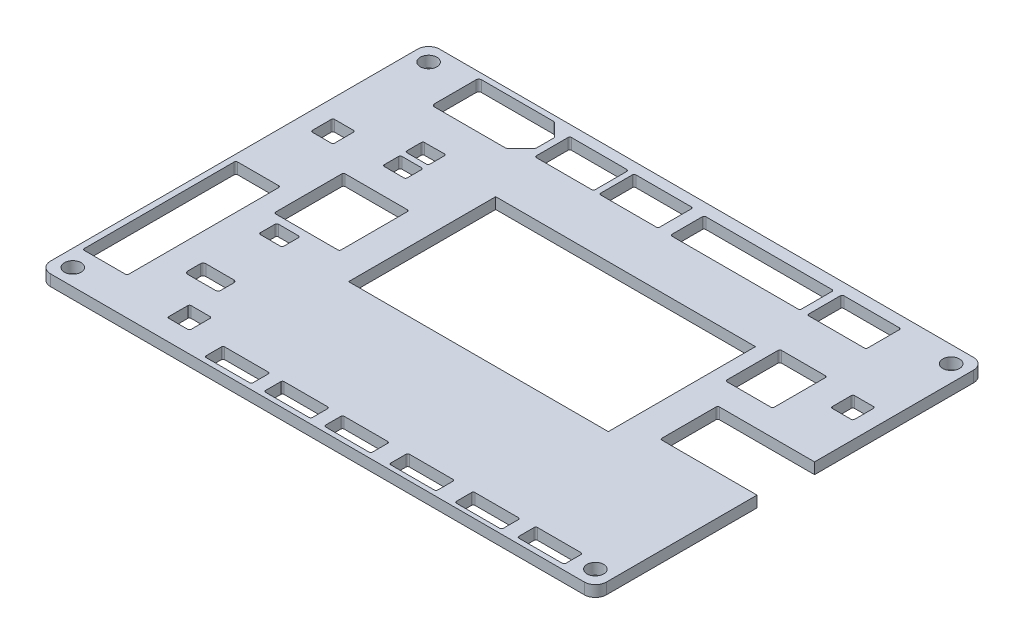
from build123d import *

# Parameters (mm, degrees)
SKETCH_1_R          = 1.5
EXTRUDE_1_DEPTH     = 2
SKETCH_2_W          = 46.726665624
SKETCH_2_H          = 26.469314584
CUT_EXTRUDE_1_DEPTH = 2


with BuildPart() as part:
    # 草图1 → 凸台-拉伸1 (new body)
    with BuildSketch(Plane(origin=(0, 0, 0), x_dir=(1, 0, 0), z_dir=(0, 1, 0))):
        with BuildLine():
            Line((-48, 35), (48, 35))
            ThreePointArc((48, 35), (49.414213562, 34.414213562), (50, 33))
            Line((50, 33), (50, -33))
            ThreePointArc((50, -33), (49.414213562, -34.414213562), (48, -35))
            Line((48, -35), (-48, -35))
            ThreePointArc((-48, -35), (-49.414213562, -34.414213562), (-50, -33))
            Line((-50, -33), (-50, 33))
            ThreePointArc((-50, 33), (-49.414213562, 34.414213562), (-48, 35))
        make_face()
        with Locations(Location((-47, 32, 0), (0, 0, 270))):
            Circle(SKETCH_1_R, mode=Mode.SUBTRACT)
        with Locations(Location((-47, -32, 0), (0, 0, 90))):
            Circle(SKETCH_1_R, mode=Mode.SUBTRACT)
        with Locations(Location((47, -32, 0), (0, 0, 270))):
            Circle(SKETCH_1_R, mode=Mode.SUBTRACT)
        with Locations(Location((47, 32, 0), (0, 0, 90))):
            Circle(SKETCH_1_R, mode=Mode.SUBTRACT)
    extrude(amount=EXTRUDE_1_DEPTH)

    # 草图2 → 切除-拉伸1 (cut)
    with BuildSketch(Plane(origin=(0, 2, 0), x_dir=(1, 0, 0), z_dir=(0, 1, 0))):
        with BuildLine():
            Line((-39.46866551, 34), (-26.523968408, 34))
            ThreePointArc((-26.523968408, 34), (-26.332626692, 33.961939766), (-26.170415017, 33.853553391))
            Line((-26.170415017, 33.853553391), (-24.054594438, 31.737732811))
            ThreePointArc((-24.054594438, 31.737732811), (-23.946208062, 31.575521137), (-23.908147829, 31.384179421))
            Line((-23.908147829, 31.384179421), (-23.908147829, 28.356333688))
            ThreePointArc((-23.908147829, 28.356333688), (-23.946208062, 28.164991972), (-24.054594438, 28.002780298))
            Line((-24.054594438, 28.002780298), (-26.385088906, 25.67228583))
            ThreePointArc((-26.385088906, 25.67228583), (-26.54730058, 25.563899454), (-26.738642296, 25.525839221))
            Line((-26.738642296, 25.525839221), (-39.46866551, 25.525839221))
            ThreePointArc((-39.46866551, 25.525839221), (-39.822218901, 25.67228583), (-39.96866551, 26.025839221))
            Line((-39.96866551, 26.025839221), (-39.96866551, 33.5))
            ThreePointArc((-39.96866551, 33.5), (-39.822218901, 33.853553391), (-39.46866551, 34))
        make_face()
        with BuildLine():
            Line((-46.520065793, 14.605798385), (-43.120065793, 14.605798385))
            ThreePointArc((-43.120065793, 14.605798385), (-42.907933759, 14.51793042), (-42.820065793, 14.305798385))
            Line((-42.820065793, 14.305798385), (-42.820065793, 10.905798385))
            ThreePointArc((-42.820065793, 10.905798385), (-42.907933759, 10.693666351), (-43.120065793, 10.605798385))
            Line((-43.120065793, 10.605798385), (-46.520065793, 10.605798385))
            ThreePointArc((-46.520065793, 10.605798385), (-46.732197828, 10.693666351), (-46.820065793, 10.905798385))
            Line((-46.820065793, 10.905798385), (-46.820065793, 14.305798385))
            ThreePointArc((-46.820065793, 14.305798385), (-46.732197828, 14.51793042), (-46.520065793, 14.605798385))
        make_face()
        with BuildLine():
            Line((-30.416933549, -27.303785472), (-27.016933549, -27.303785472))
            ThreePointArc((-27.016933549, -27.303785472), (-26.804801515, -27.391653437), (-26.716933549, -27.603785472))
            Line((-26.716933549, -27.603785472), (-26.716933549, -31.003785472))
            ThreePointArc((-26.716933549, -31.003785472), (-26.804801515, -31.215917506), (-27.016933549, -31.303785472))
            Line((-27.016933549, -31.303785472), (-30.416933549, -31.303785472))
            ThreePointArc((-30.416933549, -31.303785472), (-30.629065583, -31.215917506), (-30.716933549, -31.003785472))
            Line((-30.716933549, -31.003785472), (-30.716933549, -27.603785472))
            ThreePointArc((-30.716933549, -27.603785472), (-30.629065583, -27.391653437), (-30.416933549, -27.303785472))
        make_face()
        with BuildLine():
            Line((43.275791048, 18.342649885), (46.675791048, 18.342649885))
            ThreePointArc((46.675791048, 18.342649885), (46.887923083, 18.254781919), (46.975791048, 18.042649885))
            Line((46.975791048, 18.042649885), (46.975791048, 14.642649885))
            ThreePointArc((46.975791048, 14.642649885), (46.887923083, 14.430517851), (46.675791048, 14.342649885))
            Line((46.675791048, 14.342649885), (43.275791048, 14.342649885))
            ThreePointArc((43.275791048, 14.342649885), (43.063659014, 14.430517851), (42.975791048, 14.642649885))
            Line((42.975791048, 14.642649885), (42.975791048, 18.042649885))
            ThreePointArc((42.975791048, 18.042649885), (43.063659014, 18.254781919), (43.275791048, 18.342649885))
        make_face()
        with BuildLine():
            Line((-48.919287341, -14.819284761), (-48.919287341, -28.019284761))
            ThreePointArc((-48.919287341, -28.019284761), (-48.831419376, -28.231416796), (-48.619287341, -28.319284761))
            Line((-48.619287341, -28.319284761), (-41.219287341, -28.319284761))
            ThreePointArc((-41.219287341, -28.319284761), (-41.007155307, -28.231416796), (-40.919287341, -28.019284761))
            Line((-40.919287341, -28.019284761), (-40.919287341, -14.819284761))
            Line((-40.919287341, -14.819284761), (-40.919287341, -1.047678618))
            ThreePointArc((-40.919287341, -1.047678618), (-41.007155307, -0.835546583), (-41.219287341, -0.747678618))
            Line((-41.219287341, -0.747678618), (-48.619287341, -0.747678618))
            ThreePointArc((-48.619287341, -0.747678618), (-48.831419376, -0.835546583), (-48.919287341, -1.047678618))
            Line((-48.919287341, -1.047678618), (-48.919287341, -14.819284761))
        make_face()
        with BuildLine():
            Line((-22.406238703, 33.090990125), (-12.432067564, 33.090990125))
            ThreePointArc((-12.432067564, 33.090990125), (-12.21993553, 33.003122159), (-12.132067564, 32.790990125))
            Line((-12.132067564, 32.790990125), (-12.132067564, 27.090990125))
            ThreePointArc((-12.132067564, 27.090990125), (-12.21993553, 26.878858091), (-12.432067564, 26.790990125))
            Line((-12.432067564, 26.790990125), (-22.406238703, 26.790990125))
            ThreePointArc((-22.406238703, 26.790990125), (-22.618370738, 26.878858091), (-22.706238703, 27.090990125))
            Line((-22.706238703, 27.090990125), (-22.706238703, 32.790990125))
            ThreePointArc((-22.706238703, 32.790990125), (-22.618370738, 33.003122159), (-22.406238703, 33.090990125))
        make_face()
        with BuildLine():
            Line((-10.798844298, 33.065590074), (-0.798844298, 33.065590074))
            ThreePointArc((-0.798844298, 33.065590074), (-0.586712263, 32.977722109), (-0.498844298, 32.765590074))
            Line((-0.498844298, 32.765590074), (-0.498844298, 27.065590074))
            ThreePointArc((-0.498844298, 27.065590074), (-0.586712263, 26.85345804), (-0.798844298, 26.765590074))
            Line((-0.798844298, 26.765590074), (-10.798844298, 26.765590074))
            ThreePointArc((-10.798844298, 26.765590074), (-11.010976332, 26.85345804), (-11.098844298, 27.065590074))
            Line((-11.098844298, 27.065590074), (-11.098844298, 32.765590074))
            ThreePointArc((-11.098844298, 32.765590074), (-11.010976332, 32.977722109), (-10.798844298, 33.065590074))
        make_face()
        with BuildLine():
            Line((26.736240792, 32.941019019), (36.736240792, 32.941019019))
            ThreePointArc((36.736240792, 32.941019019), (36.948372827, 32.853151053), (37.036240792, 32.641019019))
            Line((37.036240792, 32.641019019), (37.036240792, 26.941019019))
            ThreePointArc((37.036240792, 26.941019019), (36.948372827, 26.728886985), (36.736240792, 26.641019019))
            Line((36.736240792, 26.641019019), (26.736240792, 26.641019019))
            ThreePointArc((26.736240792, 26.641019019), (26.524108758, 26.728886985), (26.436240792, 26.941019019))
            Line((26.436240792, 26.941019019), (26.436240792, 32.641019019))
            ThreePointArc((26.436240792, 32.641019019), (26.524108758, 32.853151053), (26.736240792, 32.941019019))
        make_face()
        with BuildLine():
            Line((29.645652493, 18.819876501), (37.553736378, 18.819876501))
            ThreePointArc((37.553736378, 18.819876501), (37.765868412, 18.732008535), (37.853736378, 18.519876501))
            Line((37.853736378, 18.519876501), (37.853736378, 9.31794124))
            ThreePointArc((37.853736378, 9.31794124), (37.765868412, 9.105809206), (37.553736378, 9.01794124))
            Line((37.553736378, 9.01794124), (29.645652493, 9.01794124))
            ThreePointArc((29.645652493, 9.01794124), (29.433520458, 9.105809206), (29.345652493, 9.31794124))
            Line((29.345652493, 9.31794124), (29.345652493, 18.519876501))
            ThreePointArc((29.345652493, 18.519876501), (29.433520458, 18.732008535), (29.645652493, 18.819876501))
        make_face()
        with BuildLine():
            Line((-35.609413259, -19.454234188), (-30.610935325, -19.454234188))
            ThreePointArc((-30.610935325, -19.454234188), (-30.25684503, -19.601218519), (-30.110937635, -19.955753938))
            Line((-30.110937635, -19.955753938), (-30.117900649, -22.246585437))
            ThreePointArc((-30.117900649, -22.246585437), (-30.264587225, -22.598861189), (-30.617063616, -22.74506499))
            Line((-30.617063616, -22.74506499), (-35.608578535, -22.75339807))
            ThreePointArc((-35.608578535, -22.75339807), (-35.962671407, -22.607247154), (-36.109413259, -22.253398767))
            Line((-36.109413259, -22.253398767), (-36.109413259, -19.954234188))
            ThreePointArc((-36.109413259, -19.954234188), (-35.962966649, -19.600680798), (-35.609413259, -19.454234188))
        make_face()
        with BuildLine():
            Line((-34.82878394, 19.093538514), (-31.275254797, 19.119741345))
            ThreePointArc((-31.275254797, 19.119741345), (-31.061694228, 19.032662181), (-30.973042732, 18.819749501))
            Line((-30.973042732, 18.819749501), (-30.973042732, 16.194190061))
            ThreePointArc((-30.973042732, 16.194190061), (-31.061694228, 15.98127738), (-31.275254797, 15.894198217))
            Line((-31.275254797, 15.894198217), (-34.82878394, 15.920401047))
            ThreePointArc((-34.82878394, 15.920401047), (-35.039484556, 16.009044388), (-35.126571875, 16.220392892))
            Line((-35.126571875, 16.220392892), (-35.126571875, 18.79354667))
            ThreePointArc((-35.126571875, 18.79354667), (-35.039484556, 19.004895174), (-34.82878394, 19.093538514))
        make_face()
        with BuildLine():
            Line((-30.872513335, 12.031588479), (-30.872513335, 14.600334319))
            ThreePointArc((-30.872513335, 14.600334319), (-30.9603813, 14.812466353), (-31.172513335, 14.900334319))
            Line((-31.172513335, 14.900334319), (-34.699571621, 14.900334319))
            ThreePointArc((-34.699571621, 14.900334319), (-34.911703656, 14.812466353), (-34.999571621, 14.600334319))
            Line((-34.999571621, 14.600334319), (-34.999571621, 12.031588479))
            ThreePointArc((-34.999571621, 12.031588479), (-34.911703656, 11.819456444), (-34.699571621, 11.731588479))
            Line((-34.699571621, 11.731588479), (-31.172513335, 11.731588479))
            ThreePointArc((-31.172513335, 11.731588479), (-30.9603813, 11.819456444), (-30.872513335, 12.031588479))
        make_face()
        with BuildLine():
            Line((-37.08900809, 7.084112602), (-25.901211213, 7.084112602))
            ThreePointArc((-25.901211213, 7.084112602), (-25.689079179, 6.996244636), (-25.601211213, 6.784112602))
            Line((-25.601211213, 6.784112602), (-25.601211213, -5.127960627))
            ThreePointArc((-25.601211213, -5.127960627), (-25.689079179, -5.340092661), (-25.901211213, -5.427960627))
            Line((-25.901211213, -5.427960627), (-30.177801187, -5.427960627))
            Line((-30.177801187, -5.427960627), (-37.08900809, -5.427960627))
            ThreePointArc((-37.08900809, -5.427960627), (-37.301140124, -5.340092661), (-37.38900809, -5.127960627))
            Line((-37.38900809, -5.127960627), (-37.38900809, 6.784112602))
            ThreePointArc((-37.38900809, 6.784112602), (-37.301140124, 6.996244636), (-37.08900809, 7.084112602))
        make_face()
        with BuildLine():
            Line((-31.335528657, -7.068373949), (-31.335528657, -9.718753718))
            ThreePointArc((-31.335528657, -9.718753718), (-31.423396623, -9.930885753), (-31.635528657, -10.018753718))
            Line((-31.635528657, -10.018753718), (-35.247288359, -10.018753718))
            ThreePointArc((-35.247288359, -10.018753718), (-35.459420393, -9.930885753), (-35.547288359, -9.718753718))
            Line((-35.547288359, -9.718753718), (-35.547288359, -7.068373949))
            ThreePointArc((-35.547288359, -7.068373949), (-35.459420393, -6.856241914), (-35.247288359, -6.768373949))
            Line((-35.247288359, -6.768373949), (-31.635528657, -6.768373949))
            ThreePointArc((-31.635528657, -6.768373949), (-31.423396623, -6.856241914), (-31.335528657, -7.068373949))
        make_face()
        with Locations((3.37290798, 3.823512384)):
            Rectangle(SKETCH_2_W, SKETCH_2_H)
        with BuildLine():
            Line((-20.960939859, -30.718928099), (-13.130939745, -30.718928099))
            ThreePointArc((-13.130939745, -30.718928099), (-12.91880771, -30.806796064), (-12.830939745, -31.018928099))
            Line((-12.830939745, -31.018928099), (-12.830939745, -33.758928137))
            ThreePointArc((-12.830939745, -33.758928137), (-12.91880771, -33.971060171), (-13.130939745, -34.058928137))
            Line((-13.130939745, -34.058928137), (-20.960939859, -34.058928137))
            ThreePointArc((-20.960939859, -34.058928137), (-21.173071893, -33.971060171), (-21.260939859, -33.758928137))
            Line((-21.260939859, -33.758928137), (-21.260939859, -31.018928099))
            ThreePointArc((-21.260939859, -31.018928099), (-21.173071893, -30.806796064), (-20.960939859, -30.718928099))
        make_face()
        with BuildLine():
            Line((-2.076050235, -31.081539224), (-2.076050235, -33.821539262))
            ThreePointArc((-2.076050235, -33.821539262), (-2.1639182, -34.033671297), (-2.376050235, -34.121539262))
            Line((-2.376050235, -34.121539262), (-10.206050349, -34.121539262))
            ThreePointArc((-10.206050349, -34.121539262), (-10.418182384, -34.033671297), (-10.506050349, -33.821539262))
            Line((-10.506050349, -33.821539262), (-10.506050349, -31.081539224))
            ThreePointArc((-10.506050349, -31.081539224), (-10.418182384, -30.86940719), (-10.206050349, -30.781539224))
            Line((-10.206050349, -30.781539224), (-2.376050235, -30.781539224))
            ThreePointArc((-2.376050235, -30.781539224), (-2.1639182, -30.86940719), (-2.076050235, -31.081539224))
        make_face()
        with BuildLine():
            Line((8.718971355, -31.081539224), (8.718971355, -33.821539262))
            ThreePointArc((8.718971355, -33.821539262), (8.63110339, -34.033671297), (8.418971355, -34.121539262))
            Line((8.418971355, -34.121539262), (0.588971241, -34.121539262))
            ThreePointArc((0.588971241, -34.121539262), (0.376839206, -34.033671297), (0.288971241, -33.821539262))
            Line((0.288971241, -33.821539262), (0.288971241, -31.081539224))
            ThreePointArc((0.288971241, -31.081539224), (0.376839206, -30.86940719), (0.588971241, -30.781539224))
            Line((0.588971241, -30.781539224), (8.418971355, -30.781539224))
            ThreePointArc((8.418971355, -30.781539224), (8.63110339, -30.86940719), (8.718971355, -31.081539224))
        make_face()
        with BuildLine():
            Line((12.363926791, -30.820401302), (20.193926905, -30.820401302))
            ThreePointArc((20.193926905, -30.820401302), (20.40605894, -30.908269267), (20.493926905, -31.120401302))
            Line((20.493926905, -31.120401302), (20.493926905, -33.86040134))
            ThreePointArc((20.493926905, -33.86040134), (20.40605894, -34.072533374), (20.193926905, -34.16040134))
            Line((20.193926905, -34.16040134), (12.363926791, -34.16040134))
            ThreePointArc((12.363926791, -34.16040134), (12.151794756, -34.072533374), (12.063926791, -33.86040134))
            Line((12.063926791, -33.86040134), (12.063926791, -31.120401302))
            ThreePointArc((12.063926791, -31.120401302), (12.151794756, -30.908269267), (12.363926791, -30.820401302))
        make_face()
        with BuildLine():
            Line((23.925750514, -31.196601454), (23.925750514, -33.936601492))
            ThreePointArc((23.925750514, -33.936601492), (24.01361848, -34.148733527), (24.225750514, -34.236601492))
            Line((24.225750514, -34.236601492), (32.055750629, -34.236601492))
            ThreePointArc((32.055750629, -34.236601492), (32.267882663, -34.148733527), (32.355750629, -33.936601492))
            Line((32.355750629, -33.936601492), (32.355750629, -31.196601454))
            ThreePointArc((32.355750629, -31.196601454), (32.267882663, -30.98446942), (32.055750629, -30.896601454))
            Line((32.055750629, -30.896601454), (24.225750514, -30.896601454))
            ThreePointArc((24.225750514, -30.896601454), (24.01361848, -30.98446942), (23.925750514, -31.196601454))
        make_face()
        with BuildLine():
            Line((43.430172778, -31.018801099), (43.430172778, -33.758801137))
            ThreePointArc((43.430172778, -33.758801137), (43.342304812, -33.970933171), (43.130172778, -34.058801137))
            Line((43.130172778, -34.058801137), (35.300172663, -34.058801137))
            ThreePointArc((35.300172663, -34.058801137), (35.088040629, -33.970933171), (35.000172663, -33.758801137))
            Line((35.000172663, -33.758801137), (35.000172663, -31.018801099))
            ThreePointArc((35.000172663, -31.018801099), (35.088040629, -30.806669064), (35.300172663, -30.718801099))
            Line((35.300172663, -30.718801099), (43.130172778, -30.718801099))
            ThreePointArc((43.130172778, -30.718801099), (43.342304812, -30.806669064), (43.430172778, -31.018801099))
        make_face()
        with BuildLine():
            Line((32.881239716, 4.423794775), (50, 4.423794775))
            Line((50, 4.423794775), (50, -5.924922591))
            Line((50, -5.924922591), (32.881239716, -5.924922591))
            ThreePointArc((32.881239716, -5.924922591), (32.669107682, -5.837054626), (32.581239716, -5.624922591))
            Line((32.581239716, -5.624922591), (32.581239716, 4.123794775))
            ThreePointArc((32.581239716, 4.123794775), (32.669107682, 4.335926809), (32.881239716, 4.423794775))
        make_face()
        with BuildLine():
            Line((2.017056058, 32.836539868), (24.719093294, 32.836539868))
            ThreePointArc((24.719093294, 32.836539868), (24.931225329, 32.748671902), (25.019093294, 32.536539868))
            Line((25.019093294, 32.536539868), (25.019093294, 27.052121405))
            ThreePointArc((25.019093294, 27.052121405), (24.931225329, 26.83998937), (24.719093294, 26.752121405))
            Line((24.719093294, 26.752121405), (2.017056058, 26.752121405))
            ThreePointArc((2.017056058, 26.752121405), (1.804924023, 26.83998937), (1.717056058, 27.052121405))
            Line((1.717056058, 27.052121405), (1.717056058, 32.536539868))
            ThreePointArc((1.717056058, 32.536539868), (1.804924023, 32.748671902), (2.017056058, 32.836539868))
        make_face()
    extrude(amount=-CUT_EXTRUDE_1_DEPTH, mode=Mode.SUBTRACT)


solid = part.part
